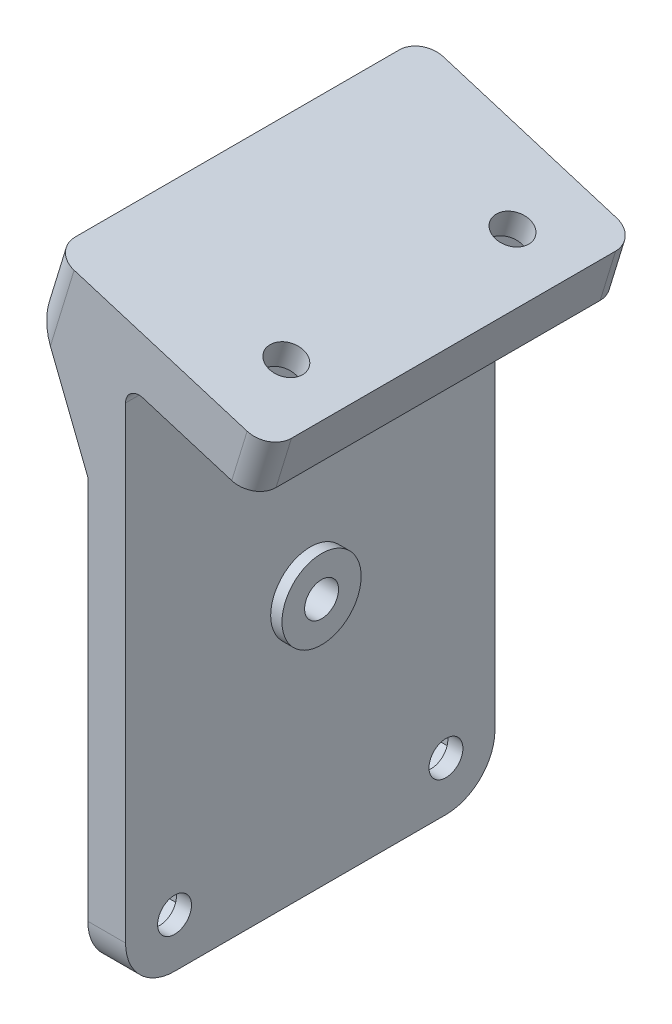
from build123d import *

# Parameters (mm, degrees)
BOSS_EXTRU_1_DEPTH                  = 49
ENL_V_MAT_EXTRU_1_REACH             = 107.293
ESQUISSE2_R                         = 2.25
ENL_V_MAT_EXTRU_1_DIRECTION_2_DEPTH = 106.292792514
ENL_V_MAT_EXTRU_2_REACH             = 104.484
ESQUISSE3_R                         = 2.25
ENL_V_START                         = -5
ENL_V_MAT_EXTRU_3_DEPTH             = 5
CONG_1_R                            = 3
ENL_V_START_2                       = -7
ENL_V_MAT_EXTRU_4_DEPTH             = 3.5
BOSS_EXTRU_2_DEPTH                  = 49
CONG_2_R                            = 1.8
CONG_3_R                            = 3
ENL_V_MAT_EXTRU_5_DEPTH             = 102.661483921
ENL_V_MAT_EXTRU_5_DEPTH_BACK        = 102.661483921
ESQUISSE8_W                         = 36
ESQUISSE8_H                         = 16
BOSS_EXTRU_3_START                  = 1.5
ESQUISSE9_R                         = 5.25
ESQUISSE9_R_2                       = 2.25
BOSS_EXTRU_3_DEPTH                  = 1.5
ENL_V_MAT_EXTRU_6_DEPTH             = 3


with BuildPart() as part:
    # Esquisse1 → Boss.-Extru.1 (new body)
    with BuildSketch(Plane.XY):
        Polygon((0, 0), (-28.689142679, 8.771151142), (-30.735744612, 2.07701785), (-24, 0.01769406), (-24, -87.98230594), (-19, -87.98230594), (-19, -1.510959348), (-2.046601933, -6.694133292), align=None)
    extrude(amount=BOSS_EXTRU_1_DEPTH)

    # Esquisse2 → Enlèv. mat.-Extru.1 (cut, up to next)
    with BuildSketch(Plane(origin=(0, 0, 0), x_dir=(0.9563047559630374, -0.2923717047227305, 0), z_dir=(0.2923717047227305, 0.9563047559630374, 0)), mode=Mode.PRIVATE) as enl_v_mat_extru_1_sk1:
        with Locations((-7.5, -9.5)):
            Circle(ESQUISSE2_R)
    enl_v_mat_extru_1_tool1 = extrude(enl_v_mat_extru_1_sk1.sketch, amount=-ENL_V_MAT_EXTRU_1_REACH, mode=Mode.PRIVATE) & part.part
    # Esquisse2 → Enlèv. mat.-Extru.1 (cut, up to next)
    with BuildSketch(Plane(origin=(0, 0, 0), x_dir=(0.9563047559630374, -0.2923717047227305, 0), z_dir=(0.2923717047227305, 0.9563047559630374, 0)), mode=Mode.PRIVATE) as enl_v_mat_extru_1_sk2:
        with Locations((-7.5, -39.5)):
            Circle(ESQUISSE2_R)
    enl_v_mat_extru_1_tool2 = extrude(enl_v_mat_extru_1_sk2.sketch, amount=-ENL_V_MAT_EXTRU_1_REACH, mode=Mode.PRIVATE) & part.part
    add(enl_v_mat_extru_1_tool1.solids().sort_by_distance((-7.172286, 2.192788, 9.5))[0], mode=Mode.SUBTRACT)
    add(enl_v_mat_extru_1_tool2.solids().sort_by_distance((-7.172286, 2.192788, 39.5))[0], mode=Mode.SUBTRACT)

    # Esquisse2 → Enlèv. mat.-Extru.1 direction 2 (cut)
    with BuildSketch(Plane(origin=(0, 0, 0), x_dir=(0.9563047559630374, -0.2923717047227305, 0), z_dir=(0.2923717047227305, 0.9563047559630374, 0))):
        with Locations((-7.5, -9.5)):
            Circle(ESQUISSE2_R)
        with Locations((-7.5, -39.5)):
            Circle(ESQUISSE2_R)
    extrude(amount=ENL_V_MAT_EXTRU_1_DIRECTION_2_DEPTH, mode=Mode.SUBTRACT)

    # Esquisse3 → Enlèv. mat.-Extru.2 (cut, up to next)
    with BuildSketch(Plane(origin=(-19, 0, 0), x_dir=(0, 0, -1), z_dir=(1, 0, 0)), mode=Mode.PRIVATE) as enl_v_mat_extru_2_sk1:
        with Locations((-42.5, -65.98230594)):
            Circle(ESQUISSE3_R)
    enl_v_mat_extru_2_tool1 = extrude(enl_v_mat_extru_2_sk1.sketch, amount=-ENL_V_MAT_EXTRU_2_REACH, mode=Mode.PRIVATE) & part.part
    # Esquisse3 → Enlèv. mat.-Extru.2 (cut, up to next)
    with BuildSketch(Plane(origin=(-19, 0, 0), x_dir=(0, 0, -1), z_dir=(1, 0, 0)), mode=Mode.PRIVATE) as enl_v_mat_extru_2_sk2:
        with Locations(Location((-6.5, -65.98230594, 0), (0, 0, 90))):
            Circle(ESQUISSE3_R)
    enl_v_mat_extru_2_tool2 = extrude(enl_v_mat_extru_2_sk2.sketch, amount=-ENL_V_MAT_EXTRU_2_REACH, mode=Mode.PRIVATE) & part.part
    # Esquisse3 → Enlèv. mat.-Extru.2 (cut, up to next)
    with BuildSketch(Plane(origin=(-19, 0, 0), x_dir=(0, 0, -1), z_dir=(1, 0, 0)), mode=Mode.PRIVATE) as enl_v_mat_extru_2_sk3:
        with Locations((-24.5, -37.98230594)):
            Circle(ESQUISSE3_R)
    enl_v_mat_extru_2_tool3 = extrude(enl_v_mat_extru_2_sk3.sketch, amount=-ENL_V_MAT_EXTRU_2_REACH, mode=Mode.PRIVATE) & part.part
    add(enl_v_mat_extru_2_tool1.solids().sort_by_distance((-19, -65.982306, 42.5))[0], mode=Mode.SUBTRACT)
    add(enl_v_mat_extru_2_tool2.solids().sort_by_distance((-19, -65.982306, 6.5))[0], mode=Mode.SUBTRACT)
    add(enl_v_mat_extru_2_tool3.solids().sort_by_distance((-19, -37.982306, 24.5))[0], mode=Mode.SUBTRACT)

    # Esquisse4 → Enlèv. mat.-Extru.3 (cut)
    with BuildSketch(Plane(origin=(-19, 0, 0), x_dir=(0, 0, -1), z_dir=(1, 0, 0)).offset(ENL_V_START)):
        with BuildLine():
            Line((-24.5, -87.98230594), (-42.5, -72.48230594))
            ThreePointArc((-42.5, -72.48230594), (-47.096194078, -70.578500018), (-49, -65.98230594))
            Line((-49, -65.98230594), (-50, -65.98230594))
            Line((-50, -65.98230594), (-50, -88.98230594))
            Line((-50, -88.98230594), (1, -88.98230594))
            Line((1, -88.98230594), (1, -65.98230594))
            Line((1, -65.98230594), (0, -65.98230594))
            ThreePointArc((0, -65.98230594), (-1.903805922, -70.578500018), (-6.5, -72.48230594))
            Line((-6.5, -72.48230594), (-24.5, -87.98230594))
        make_face()
    extrude(amount=ENL_V_MAT_EXTRU_3_DEPTH, mode=Mode.SUBTRACT)

    # Congé1
    cong_1_edges = [part.edges().sort_by_distance(p)[0] for p in [
        (-21.5, -87.98230594, 24.5),
    ]]
    fillet(cong_1_edges, radius=CONG_1_R)

    # Esquisse5 → Enlèv. mat.-Extru.4 (cut)
    with BuildSketch(Plane(origin=(0, 0, 0), x_dir=(0.9563047559630375, -0.2923717047227304, 0), z_dir=(0.2923717047227304, 0.9563047559630375, 0)).offset(ENL_V_START_2)):
        Polygon((-3.95, -11.549593456), (-3.95, -7.450406544), (-7.5, -5.400813089), (-11.05, -7.450406544), (-11.05, -11.549593456), (-7.5, -13.599186911), align=None)
        Polygon((-7.5, -35.400813089), (-3.95, -37.450406544), (-3.95, -41.549593456), (-7.5, -43.599186911), (-11.05, -41.549593456), (-11.05, -37.450406544), align=None)
    extrude(amount=ENL_V_MAT_EXTRU_4_DEPTH, mode=Mode.SUBTRACT)

    # Esquisse6 → Boss.-Extru.2 (add)
    with BuildSketch(Plane.XY.offset(49)):
        Polygon((-30.735744612, 2.07701785), (-24, -14.98230594), (-24, 0.01769406), align=None)
    extrude(amount=-BOSS_EXTRU_2_DEPTH)

    # Congé2
    cong_2_edges = [part.edges().sort_by_distance(p)[0] for p in [
        (-19, -1.510959348, 24.5),
    ]]
    fillet(cong_2_edges, radius=CONG_2_R)

    # Congé3
    cong_3_edges = [part.edges().sort_by_distance(p)[0] for p in [
        (-29.712443645, 5.424084496, 49),
        (-1.023300967, -3.347066646, 0),
        (-1.023300967, -3.347066646, 49),
        (-29.712443645, 5.424084496, 0),
    ]]
    fillet(cong_3_edges, radius=CONG_3_R)

    # Esquisse8 → Enlèv. mat.-Extru.5 (cut, two sides: drawn at the far end of the back side and taken through both)
    with BuildSketch(Plane(origin=(-19, 0, 0), x_dir=(0, 0, -1), z_dir=(1, 0, 0)).offset(-ENL_V_MAT_EXTRU_5_DEPTH_BACK)):
        with Locations((-24.5, -80.48230594)):
            Rectangle(ESQUISSE8_W, ESQUISSE8_H)
    extrude(amount=ENL_V_MAT_EXTRU_5_DEPTH + ENL_V_MAT_EXTRU_5_DEPTH_BACK, mode=Mode.SUBTRACT)

    # Esquisse9 → Boss.-Extru.3 (add)
    with BuildSketch(Plane(origin=(-19, 0, 0), x_dir=(0, 0, -1), z_dir=(1, 0, 0)).offset(BOSS_EXTRU_3_START)):
        with Locations(Location((-24.5, -37.98230594, 0), (0, 0, 180))):
            Circle(ESQUISSE9_R)
        with Locations(Location((-24.5, -37.98230594, 0), (0, 0, 90))):
            Circle(ESQUISSE9_R_2, mode=Mode.SUBTRACT)
    extrude(amount=-BOSS_EXTRU_3_DEPTH)

    # Esquisse10 → Enlèv. mat.-Extru.6 (cut)
    with BuildSketch(Plane.ZY.offset(24)):
        Polygon((28.05, -40.031899396), (28.05, -35.932712485), (24.5, -33.883119029), (20.95, -35.932712485), (20.95, -40.031899396), (24.5, -42.081492852), align=None)
        Polygon((10.05, -68.031899396), (10.05, -63.932712485), (6.5, -61.883119029), (2.95, -63.932712485), (2.95, -68.031899396), (6.5, -70.081492852), align=None)
        Polygon((46.05, -68.031899396), (46.05, -63.932712485), (42.5, -61.883119029), (38.95, -63.932712485), (38.95, -68.031899396), (42.5, -70.081492852), align=None)
    extrude(amount=-ENL_V_MAT_EXTRU_6_DEPTH, mode=Mode.SUBTRACT)


solid = part.part
